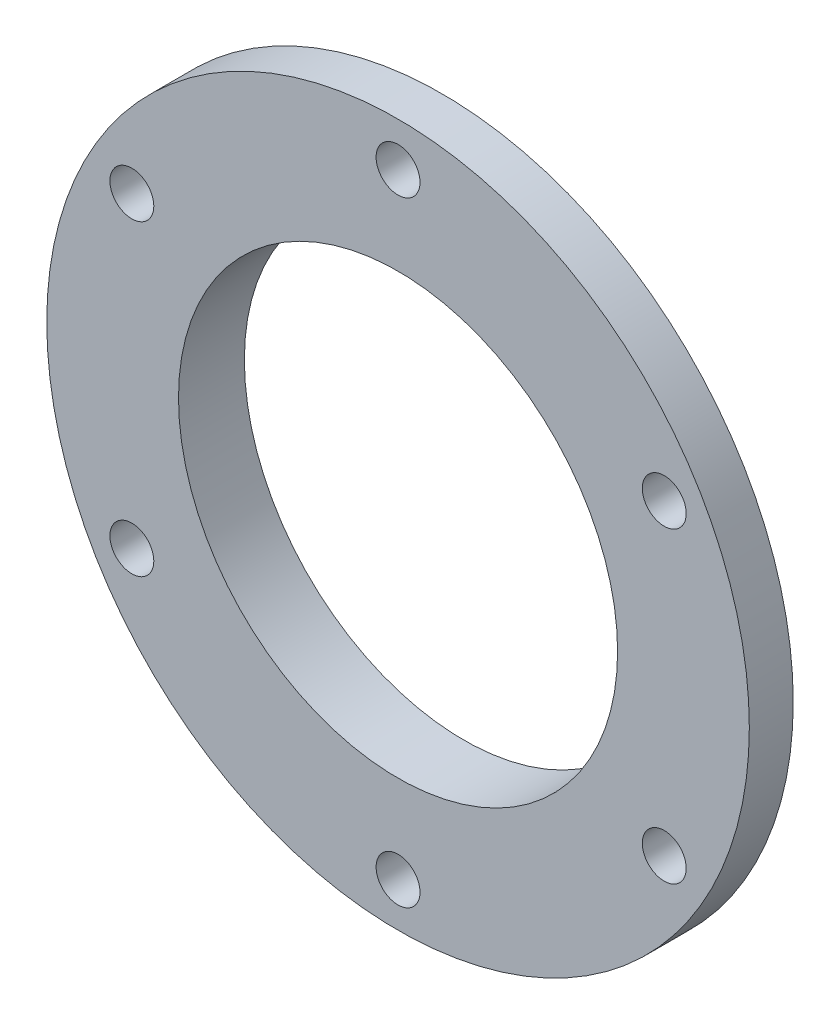
from build123d import *
from build123d.topology import SkipClean

# Parameters (mm, degrees)
SKETCH1_R              = 40
SKETCH1_R_2            = 25
BOSS_EXTRUDE1_DEPTH    = 5
SLEW_START             = 2.5
SKETCH3_R              = 30
SKETCH3_R_2            = 25
SLEW_BEARING_LIP_DEPTH = 2.5
SKETCH4_R              = 2.5
SCREW_HOLES_DEPTH      = 57.789083458


with BuildPart() as part:
    # Sketch1 → Boss-Extrude1 (new body)
    with BuildSketch(Plane.XY):
        Circle(SKETCH1_R)
        Circle(SKETCH1_R_2, mode=Mode.SUBTRACT)
    extrude(amount=BOSS_EXTRUDE1_DEPTH)

    # Sketch3 → slew bearing lip (add)
    with SkipClean():  # the faces are left unmerged after this step: merging them gives an invalid solid
        with BuildSketch(Plane(origin=(0, 0, 0), x_dir=(-1, 0, 0), z_dir=(0, 0, -1)).offset(SLEW_START)):
            with Locations(Location((0, 0, 0), (0, 0, 180))):
                Circle(SKETCH3_R)
            Circle(SKETCH3_R_2, mode=Mode.SUBTRACT)
        extrude(amount=-SLEW_BEARING_LIP_DEPTH)

    # Sketch4 → screw holes (cut, through all)
    with SkipClean():  # the faces are left unmerged after this step: merging them gives an invalid solid
        with BuildSketch(Plane.XY):
            with Locations((0, 35)):
                Circle(SKETCH4_R)
            with Locations((30.310889132, 17.5)):
                Circle(SKETCH4_R)
            with Locations((30.310889132, -17.5)):
                Circle(SKETCH4_R)
            with Locations((0, -35)):
                Circle(SKETCH4_R)
            with Locations((-30.310889132, -17.5)):
                Circle(SKETCH4_R)
            with Locations((-30.310889132, 17.5)):
                Circle(SKETCH4_R)
        extrude(amount=SCREW_HOLES_DEPTH, mode=Mode.SUBTRACT)


solid = part.part
